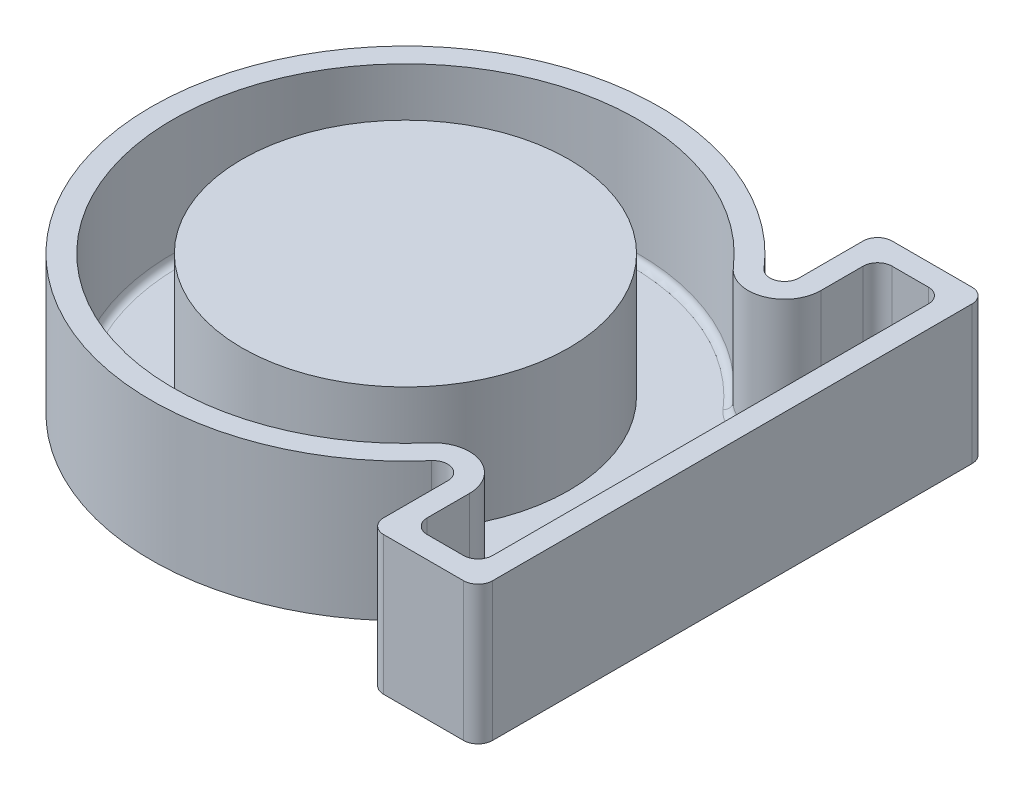
from build123d import *

# Parameters (mm, degrees)
BOSS_EXTRUDE1_DEPTH = 19.05
SKETCH3_R           = 22.5
CUT_EXTRUDE1_DEPTH  = 17
FILLET1_R           = 2
FILLET2_R           = 1


with BuildPart() as part:
    # Sketch2 → Boss-Extrude1 (new body)
    with BuildSketch(Plane(origin=(0, 0, 0), x_dir=(1, 0, 0), z_dir=(0, 1, 0))):
        with BuildLine():
            Line((79.031032842, 24.025126848), (79.031032842, 15.211900093))
            ThreePointArc((79.031032842, 15.211900093), (79.61681928, 13.797686531), (81.031032842, 13.211900093))
            Line((81.031032842, 13.211900093), (92.031032842, 13.211900093))
            ThreePointArc((92.031032842, 13.211900093), (93.445246404, 13.797686531), (94.031032842, 15.211900093))
            Line((94.031032842, 15.211900093), (94.031032842, 81.211900093))
            ThreePointArc((94.031032842, 81.211900093), (93.445246404, 82.626113656), (92.031032842, 83.211900093))
            Line((92.031032842, 83.211900093), (81.031032842, 83.211900093))
            ThreePointArc((81.031032842, 83.211900093), (79.61681928, 82.626113656), (79.031032842, 81.211900093))
            Line((79.031032842, 81.211900093), (79.031032842, 72.398673338))
            ThreePointArc((79.031032842, 72.398673338), (77.728518675, 70.524236486), (75.517519329, 71.09128019))
            ThreePointArc((75.517519329, 71.09128019), (14.031032842, 48.211900093), (75.517519329, 25.332519997))
            ThreePointArc((75.517519329, 25.332519997), (77.728518675, 25.899563701), (79.031032842, 24.025126848))
        make_face()
    extrude(amount=BOSS_EXTRUDE1_DEPTH)

    # Sketch3 → Cut-Extrude1 (cut)
    with BuildSketch(Plane(origin=(0, 19.05, 0), x_dir=(1, 0, 0), z_dir=(0, 1, 0))):
        with BuildLine():
            Line((82.031032842, 16.211900093), (91.031032842, 16.211900093))
            Line((91.031032842, 16.211900093), (91.031032842, 80.211900093))
            Line((91.031032842, 80.211900093), (82.031032842, 80.211900093))
            Line((82.031032842, 80.211900093), (82.031032842, 72.398673338))
            ThreePointArc((82.031032842, 72.398673338), (78.774747423, 67.712581207), (73.247249058, 69.130190467))
            ThreePointArc((73.247249058, 69.130190467), (17.031032842, 48.211900093), (73.247249058, 27.293609719))
            ThreePointArc((73.247249058, 27.293609719), (78.774747423, 28.711218979), (82.031032842, 24.025126848))
            Line((82.031032842, 24.025126848), (82.031032842, 16.211900093))
        make_face()
        with Locations(Location((49.031032842, 48.211900093, 0), (0, 0, 270))):
            Circle(SKETCH3_R, mode=Mode.SUBTRACT)
    extrude(amount=-CUT_EXTRUDE1_DEPTH, mode=Mode.SUBTRACT)

    # Fillet1
    fillet1_edges = [part.edges().sort_by_distance(p)[0] for p in [
        (82.031032842, 10.55, -16.211900093),
        (82.031032842, 10.55, -80.211900093),
        (91.031032842, 10.55, -80.211900093),
        (91.031032842, 10.55, -16.211900093),
    ]]
    fillet(fillet1_edges, radius=FILLET1_R)

    # Fillet2
    fillet2_edges = [part.edges().sort_by_distance(p)[0] for p in [
        (82.031032842, 2.05, -21.118513471),
        (78.774747423, 2.05, -28.711218979),
        (17.031032842, 2.05, -48.211900093),
        (78.774747423, 2.05, -67.712581207),
        (91.031032842, 2.05, -48.211900093),
        (86.531032842, 2.05, -16.211900093),
        (86.531032842, 2.05, -80.211900093),
        (82.031032842, 2.05, -75.305286716),
        (82.61681928, 2.05, -79.626113656),
        (90.445246404, 2.05, -79.626113656),
        (82.61681928, 2.05, -16.797686531),
        (90.445246404, 2.05, -16.797686531),
    ]]
    fillet(fillet2_edges, radius=FILLET2_R)


solid = part.part
